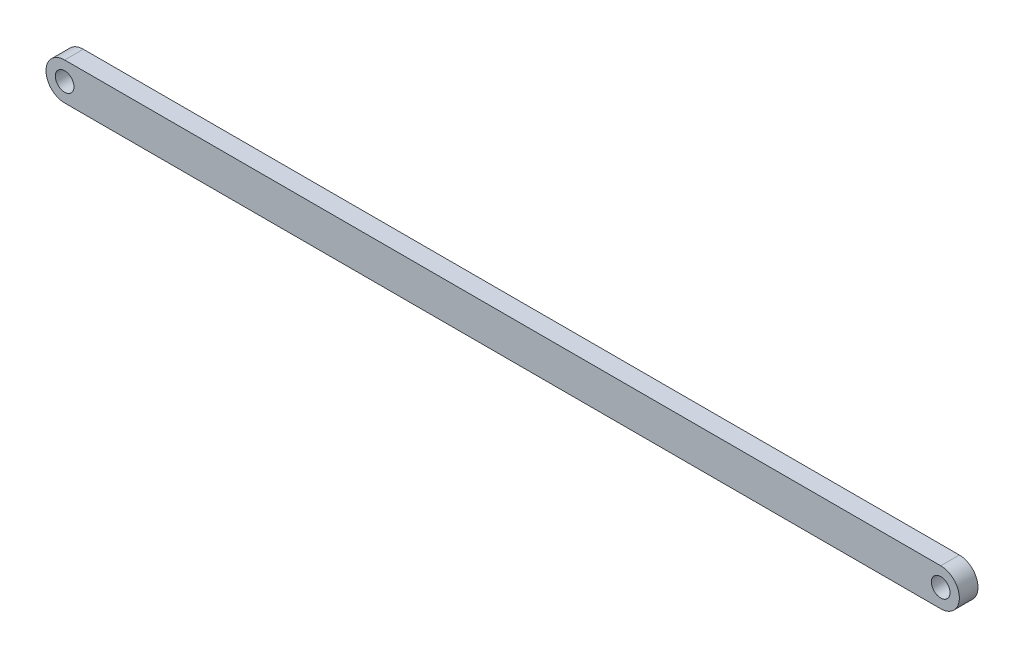
from build123d import *

# Parameters (mm, degrees)
SKETCH_1_R      = 25
EXTRUDE_1_DEPTH = 50


with BuildPart() as part:
    # 草图1 → 拉伸1 (new body)
    with BuildSketch(Plane.XY):
        with BuildLine():
            Line((0, 50), (2350, 50))
            ThreePointArc((2350, 50), (2400, 0), (2350, -50))
            Line((2350, -50), (0, -50))
            ThreePointArc((0, -50), (-50, 0), (0, 50))
        make_face()
        Circle(SKETCH_1_R, mode=Mode.SUBTRACT)
        with Locations((2350, 0)):
            Circle(SKETCH_1_R, mode=Mode.SUBTRACT)
    extrude(amount=EXTRUDE_1_DEPTH)


solid = part.part
